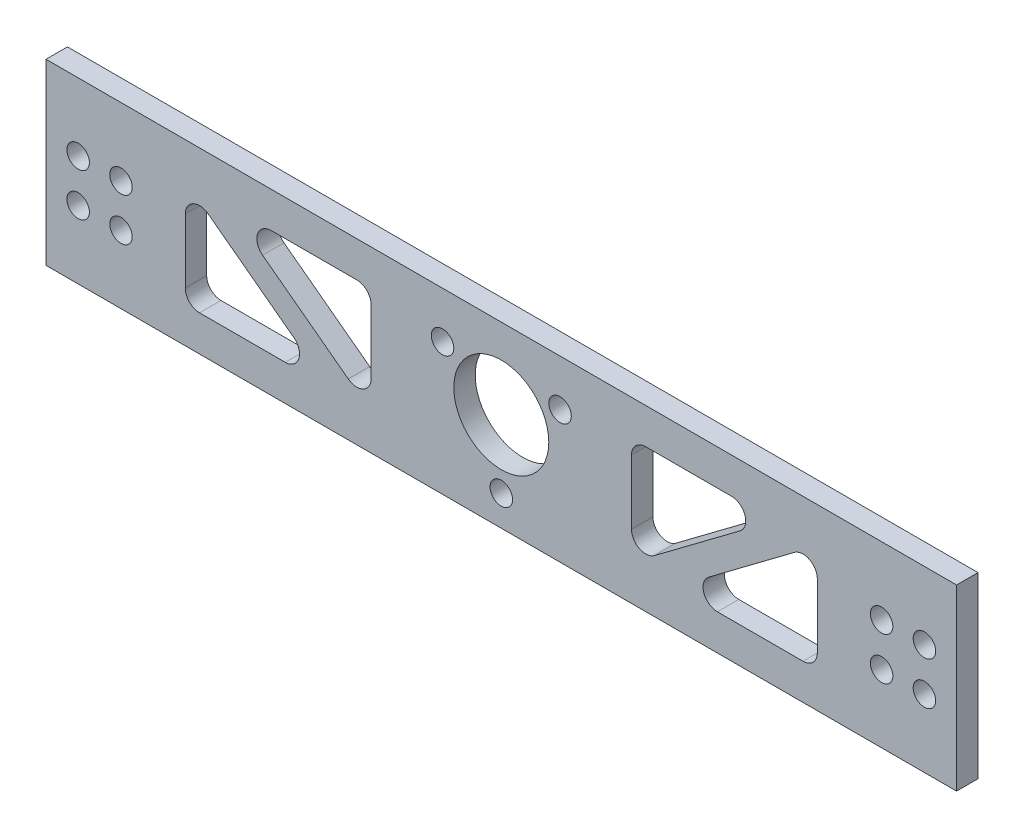
from build123d import *

# Parameters (mm, degrees)
SKETCH_1_W          = 127.5
SKETCH_1_H          = 25
EXTRUDE_1_DEPTH     = 3
SKETCH_2_R          = 1.575
SKETCH_2_R_2        = 6.65
CUT_EXTRUDE_1_DEPTH = 130.96249459
FILLET_1_R          = 2


with BuildPart() as part:
    # 草图1 → 凸台-拉伸1 (new body)
    with BuildSketch(Plane.XY):
        with Locations((63.75, -12.5)):
            Rectangle(SKETCH_1_W, SKETCH_1_H)
    extrude(amount=EXTRUDE_1_DEPTH)

    # 草图2 → 切除-拉伸1 (cut, through all)
    with BuildSketch(Plane.XY.offset(3)):
        with Locations((4.5, -9.5)):
            Circle(SKETCH_2_R)
        with Locations(Location((10.5, -9.5, 0), (0, 0, 180))):
            Circle(SKETCH_2_R)
        with Locations((10.5, -15.5)):
            Circle(SKETCH_2_R)
        with Locations(Location((4.5, -15.5, 0), (0, 0, 180))):
            Circle(SKETCH_2_R)
        with Locations((123, -15.5)):
            Circle(SKETCH_2_R)
        with Locations(Location((117, -15.5, 0), (0, 0, 180))):
            Circle(SKETCH_2_R)
        with Locations((117, -9.5)):
            Circle(SKETCH_2_R)
        with Locations(Location((123, -9.5, 0), (0, 0, 180))):
            Circle(SKETCH_2_R)
        with Locations((63.75, -11.25)):
            Circle(SKETCH_2_R_2)
        with Locations((55.522758664, -6.5)):
            Circle(SKETCH_2_R)
        with Locations((71.977241336, -6.5)):
            Circle(SKETCH_2_R)
        with Locations((63.75, -20.75)):
            Circle(SKETCH_2_R)
        Polygon((108, -5), (108, -20), (88, -20), align=None)
        Polygon((81.977241336, -5), (81.977241336, -20), (101.977241336, -5), align=None)
        Polygon((25.522758664, -5), (45.522758664, -5), (45.522758664, -20), align=None)
        Polygon((39.5, -20), (19.5, -5), (19.5, -20), align=None)
    extrude(amount=-CUT_EXTRUDE_1_DEPTH, mode=Mode.SUBTRACT)

    # 圆角1
    fillet_1_edges = [part.edges().sort_by_distance(p)[0] for p in [
        (45.522758664, -20, 1.5),
        (25.522758664, -5, 1.5),
        (45.522758664, -5, 1.5),
        (39.5, -20, 1.5),
        (19.5, -20, 1.5),
        (19.5, -5, 1.5),
        (81.977241336, -5, 1.5),
        (101.977241336, -5, 1.5),
        (81.977241336, -20, 1.5),
        (88, -20, 1.5),
        (108, -5, 1.5),
        (108, -20, 1.5),
    ]]
    fillet(fillet_1_edges, radius=FILLET_1_R)


solid = part.part
